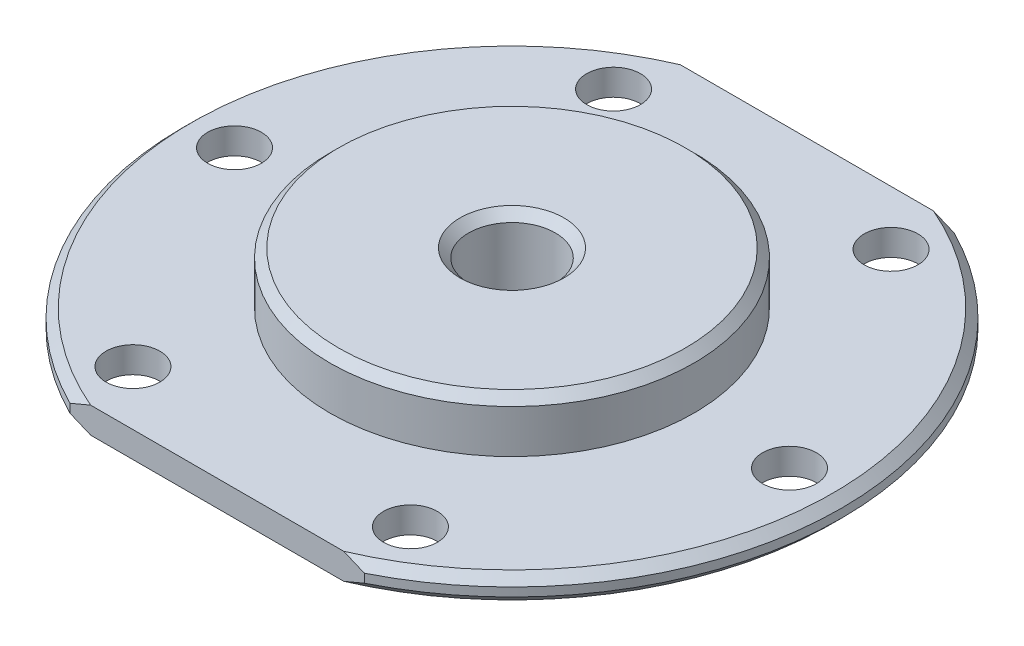
from build123d import *

# Parameters (mm, degrees)
SKETCH1_R           = 1.55
BOSS_EXTRUDE1_DEPTH = 1.5
SKETCH2_R           = 10.5
BOSS_EXTRUDE2_DEPTH = 3
SKETCH3_R           = 5
BOSS_EXTRUDE3_DEPTH = 5
SKETCH4_R           = 2.5
CUT_EXTRUDE1_DEPTH  = 28.207535721
CHAMFER1_SIZE       = 0.5


with BuildPart() as part:
    # Sketch1 → Boss-Extrude1 (new body)
    with BuildSketch(Plane(origin=(0, 0, 0), x_dir=(1, 0, 0), z_dir=(0, 1, 0))):
        with BuildLine():
            Line((-8.485281374, 17), (8.485281374, 17))
            ThreePointArc((8.485281374, 17), (19, 0), (8.485281374, -17))
            Line((8.485281374, -17), (-8.485281374, -17))
            ThreePointArc((-8.485281374, -17), (-19, 0), (-8.485281374, 17))
        make_face()
        with Locations(Location((-16, 0, 0), (0, 0, 270))):
            Circle(SKETCH1_R, mode=Mode.SUBTRACT)
        with Locations(Location((-8, 13.856406461, 0), (0, 0, 270))):
            Circle(SKETCH1_R, mode=Mode.SUBTRACT)
        with Locations(Location((8, 13.856406461, 0), (0, 0, 270))):
            Circle(SKETCH1_R, mode=Mode.SUBTRACT)
        with Locations(Location((16, 0, 0), (0, 0, 270))):
            Circle(SKETCH1_R, mode=Mode.SUBTRACT)
        with Locations(Location((8, -13.856406461, 0), (0, 0, 270))):
            Circle(SKETCH1_R, mode=Mode.SUBTRACT)
        with Locations(Location((-8, -13.856406461, 0), (0, 0, 270))):
            Circle(SKETCH1_R, mode=Mode.SUBTRACT)
    extrude(amount=BOSS_EXTRUDE1_DEPTH)

    # Sketch2 → Boss-Extrude2 (add)
    with BuildSketch(Plane(origin=(0, 1.5, 0), x_dir=(1, 0, 0), z_dir=(0, 1, 0))):
        with Locations(Location((0, 0, 0), (0, 0, 270))):
            Circle(SKETCH2_R)
    extrude(amount=BOSS_EXTRUDE2_DEPTH)

    # Sketch3 → Boss-Extrude3 (add)
    with BuildSketch(Plane.XZ):
        with Locations(Location((0, 0, 0), (0, 0, 270))):
            Circle(SKETCH3_R)
    extrude(amount=BOSS_EXTRUDE3_DEPTH)

    # Sketch4 → Cut-Extrude1 (cut, through all)
    with BuildSketch(Plane(origin=(0, 4.5, 0), x_dir=(1, 0, 0), z_dir=(0, 1, 0))):
        with Locations(Location((0, 0, 0), (0, 0, 270))):
            Circle(SKETCH4_R)
    extrude(amount=-CUT_EXTRUDE1_DEPTH, mode=Mode.SUBTRACT)

    # Chamfer1
    chamfer1_edges = [part.edges().sort_by_distance(p)[0] for p in [
        (19, 1.5, 0),
        (0, 4.5, -10.5),
        (0, -5, 5),
        (-19, 1.5, 0),
        (0, -5, -2.5),
        (0, 4.5, -2.5),
        (19, 0, 0),
        (-19, 0, 0),
    ]]
    chamfer(chamfer1_edges, length=CHAMFER1_SIZE)


solid = part.part
